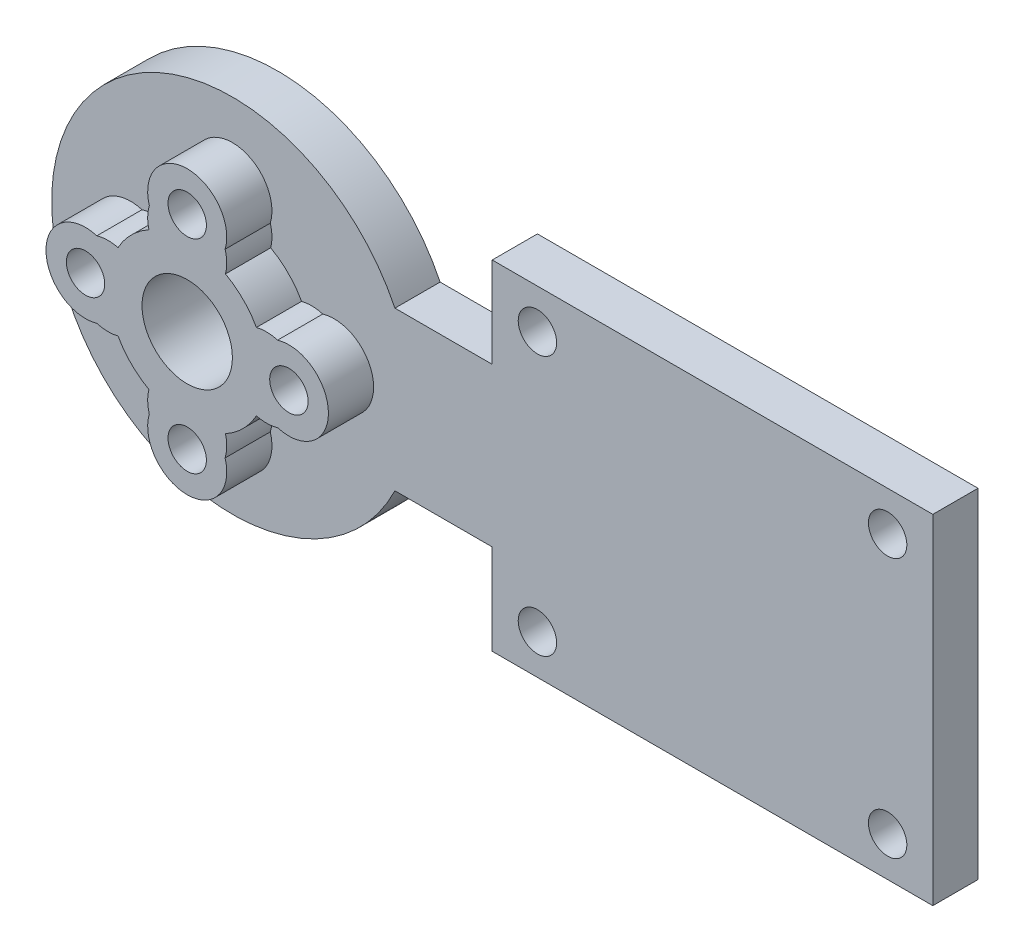
from build123d import *

# Parameters (mm, degrees)
METAL_HORN_FLANGE_PROFILE_R              = 16
METAL_HORN_FLANGE_DEPTH                  = 4
STRAIGHT_FOREARM_WEB_PROFILE_W           = 28
STRAIGHT_FOREARM_WEB_PROFILE_H           = 14
STRAIGHT_FOREARM_WEB_DEPTH               = 4
REPLACEABLE_TOOL_MOUNTING_DECK_PROFILE_W = 39
REPLACEABLE_TOOL_MOUNTING_DECK_PROFILE_H = 30
REPLACEABLE_TOOL_MOUNTING_DECK_DEPTH     = 4
DOWEL_SUPPORT_HUB_START                  = 4
DOWEL_SUPPORT_HUB_PROFILE_R              = 7
DOWEL_SUPPORT_HUB_PROFILE_R_2            = 4
DOWEL_SUPPORT_HUB_DEPTH                  = 4
WASHER_SEATS_CLEAR_DOWEL_SLEEVE_START    = 4
RAISED_WASHER_SEATS_PCD14_R              = 3.5
WASHER_SEATS_CLEAR_DOWEL_SLEEVE_DEPTH    = 4
ELBOW_SLEEVE_BORE_START                  = -50
ELBOW_SLEEVE_BORE_PROFILE_R              = 4
ELBOW_SLEEVE_BORE_DEPTH                  = 115.52906322
MODULAR_TOOL_FOUR_M3_PATTERN_START       = -50
MODULAR_TOOL_FOUR_M3_PATTERN_PROFILE_R   = 1.7
MODULAR_TOOL_FOUR_M3_PATTERN_DEPTH       = 115.52906322
PRINTED_HUB_M3_WASHER_SEATS_PCD18_START  = 4
PRINTED_HUB_WASHER_SEATS_PCD18_PROFILE_R = 3.5
PRINTED_HUB_M3_WASHER_SEATS_PCD18_DEPTH  = 4
PRINTED_HUB_M3_CLEARANCE_PCD18_START     = -50
PRINTED_HUB_M3_CLEARANCE_PCD18_PROFILE_R = 1.7
PRINTED_HUB_M3_CLEARANCE_PCD18_DEPTH     = 115.52906322


with BuildPart() as part:
    # Metal_horn_flange_profile → Metal_horn_flange (new body)
    with BuildSketch(Plane.XY):
        Circle(METAL_HORN_FLANGE_PROFILE_R)
    extrude(amount=METAL_HORN_FLANGE_DEPTH)

    # Straight_forearm_web_profile → Straight_forearm_web (add)
    with BuildSketch(Plane.XY):
        with Locations((14, 0)):
            Rectangle(STRAIGHT_FOREARM_WEB_PROFILE_W, STRAIGHT_FOREARM_WEB_PROFILE_H)
    extrude(amount=STRAIGHT_FOREARM_WEB_DEPTH)

    # Replaceable_tool_mounting_deck_profile → Replaceable_tool_mounting_deck (add)
    with BuildSketch(Plane.XY):
        with Locations((42.5, 0)):
            Rectangle(REPLACEABLE_TOOL_MOUNTING_DECK_PROFILE_W, REPLACEABLE_TOOL_MOUNTING_DECK_PROFILE_H)
    extrude(amount=REPLACEABLE_TOOL_MOUNTING_DECK_DEPTH)

    # Dowel_support_hub_profile → Dowel_support_hub (add)
    with BuildSketch(Plane.XY.offset(DOWEL_SUPPORT_HUB_START)):
        Circle(DOWEL_SUPPORT_HUB_PROFILE_R)
        Circle(DOWEL_SUPPORT_HUB_PROFILE_R_2, mode=Mode.SUBTRACT)
    extrude(amount=DOWEL_SUPPORT_HUB_DEPTH)

    # Raised_washer_seats_PCD14 → Washer_seats_clear_dowel_sleeve (add)
    with BuildSketch(Plane.XY.offset(WASHER_SEATS_CLEAR_DOWEL_SLEEVE_START)):
        with Locations((7, 0)):
            Circle(RAISED_WASHER_SEATS_PCD14_R)
        with Locations((-7, 0)):
            Circle(RAISED_WASHER_SEATS_PCD14_R)
        with Locations((0, 7)):
            Circle(RAISED_WASHER_SEATS_PCD14_R)
        with Locations((0, -7)):
            Circle(RAISED_WASHER_SEATS_PCD14_R)
    extrude(amount=WASHER_SEATS_CLEAR_DOWEL_SLEEVE_DEPTH)

    # Elbow_sleeve_bore_profile → Elbow_sleeve_bore (cut, through all)
    with BuildSketch(Plane.XY.offset(ELBOW_SLEEVE_BORE_START)):
        Circle(ELBOW_SLEEVE_BORE_PROFILE_R)
    extrude(amount=ELBOW_SLEEVE_BORE_DEPTH, mode=Mode.SUBTRACT)

    # Modular_tool_four_M3_pattern_profile → Modular_tool_four_M3_pattern (cut, through all)
    with BuildSketch(Plane.XY.offset(MODULAR_TOOL_FOUR_M3_PATTERN_START)):
        with Locations((27, -11.5)):
            Circle(MODULAR_TOOL_FOUR_M3_PATTERN_PROFILE_R)
        with Locations((27, 11.5)):
            Circle(MODULAR_TOOL_FOUR_M3_PATTERN_PROFILE_R)
        with Locations((58, -11.5)):
            Circle(MODULAR_TOOL_FOUR_M3_PATTERN_PROFILE_R)
        with Locations((58, 11.5)):
            Circle(MODULAR_TOOL_FOUR_M3_PATTERN_PROFILE_R)
    extrude(amount=MODULAR_TOOL_FOUR_M3_PATTERN_DEPTH, mode=Mode.SUBTRACT)

    # Printed_hub_washer_seats_PCD18_profile → Printed_hub_M3_washer_seats_PCD18 (add)
    with BuildSketch(Plane.XY.offset(PRINTED_HUB_M3_WASHER_SEATS_PCD18_START)):
        with Locations((9, 0)):
            Circle(PRINTED_HUB_WASHER_SEATS_PCD18_PROFILE_R)
        with Locations((0, 9)):
            Circle(PRINTED_HUB_WASHER_SEATS_PCD18_PROFILE_R)
        with Locations((-9, 0)):
            Circle(PRINTED_HUB_WASHER_SEATS_PCD18_PROFILE_R)
        with Locations((0, -9)):
            Circle(PRINTED_HUB_WASHER_SEATS_PCD18_PROFILE_R)
    extrude(amount=PRINTED_HUB_M3_WASHER_SEATS_PCD18_DEPTH)

    # Printed_hub_M3_clearance_PCD18_profile → Printed_hub_M3_clearance_PCD18 (cut, through all)
    with BuildSketch(Plane.XY.offset(PRINTED_HUB_M3_CLEARANCE_PCD18_START)):
        with Locations((9, 0)):
            Circle(PRINTED_HUB_M3_CLEARANCE_PCD18_PROFILE_R)
        with Locations((0, 9)):
            Circle(PRINTED_HUB_M3_CLEARANCE_PCD18_PROFILE_R)
        with Locations((-9, 0)):
            Circle(PRINTED_HUB_M3_CLEARANCE_PCD18_PROFILE_R)
        with Locations((0, -9)):
            Circle(PRINTED_HUB_M3_CLEARANCE_PCD18_PROFILE_R)
    extrude(amount=PRINTED_HUB_M3_CLEARANCE_PCD18_DEPTH, mode=Mode.SUBTRACT)


solid = part.part
